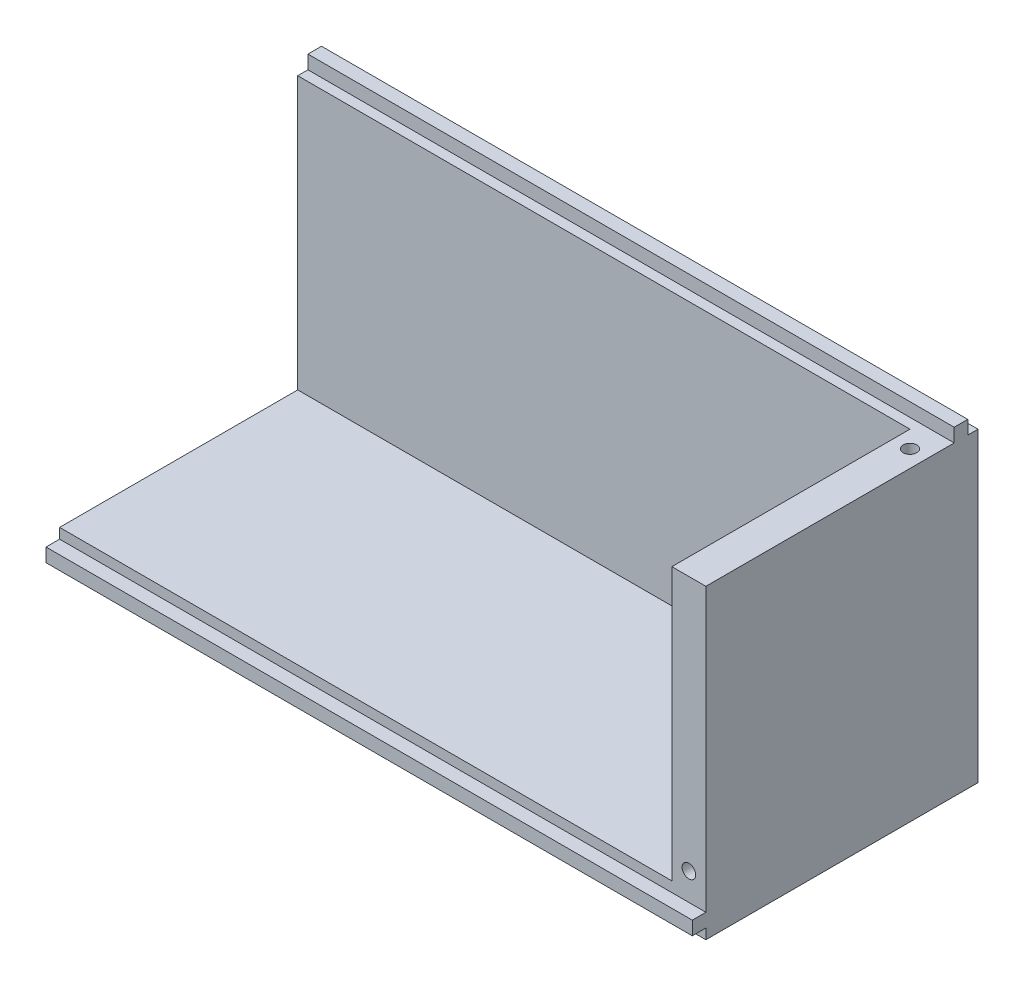
from build123d import *

# Parameters (mm, degrees)
CROQUIS1_W                                  = 95
CROQUIS1_H                                  = 40
SALIENTE_EXTRUIR1_DEPTH                     = 5
SALIENTE_EXTRUIR2_DEPTH                     = 40
CROQUIS3_W                                  = 95
CROQUIS3_H                                  = 2
SALIENTE_EXTRUIR3_DEPTH                     = 2
CROQUIS4_W                                  = 95
CROQUIS4_H                                  = 2
SALIENTE_EXTRUIR4_DEPTH                     = 2
DI_METRO_DE_TALADRO_2_0_2_1_D               = 2
DI_METRO_DE_TALADRO_2_0_2_1_DEPTH           = 10
DI_METRO_DE_TALADRO_2_0_2_1_TIP             = 0.600860619
DI_METRO_DE_TALADRO_2_0_2_2_D               = 2
DI_METRO_DE_TALADRO_2_0_2_2_DEPTH           = 10
DI_METRO_DE_TALADRO_2_0_2_2_TIP             = 0.600860619
DI_METRO_DE_TALADRO_2_0_2_2_ON_FACE_2_D     = 2
DI_METRO_DE_TALADRO_2_0_2_2_ON_FACE_2_DEPTH = 10
DI_METRO_DE_TALADRO_2_0_2_2_ON_FACE_2_TIP   = 0.600860619


with BuildPart() as part:
    # Croquis1 → Saliente-Extruir1 (new body)
    with BuildSketch(Plane(origin=(0, 0, 0), x_dir=(1, 0, 0), z_dir=(0, 1, 0))):
        with Locations((47.5, 20)):
            Rectangle(CROQUIS1_W, CROQUIS1_H)
    extrude(amount=SALIENTE_EXTRUIR1_DEPTH)

    # Croquis2 → Saliente-Extruir2 (add)
    with BuildSketch(Plane(origin=(0, 5, 0), x_dir=(1, 0, 0), z_dir=(0, 1, 0))):
        Polygon((0, 35), (90, 35), (90, 0), (95, 0), (95, 40), (0, 40), align=None)
    extrude(amount=SALIENTE_EXTRUIR2_DEPTH)

    # Croquis3 → Saliente-Extruir3 (add)
    with BuildSketch(Plane(origin=(0, 45, 0), x_dir=(1, 0, 0), z_dir=(0, 1, 0))):
        with Locations((47.5, 37.5)):
            Rectangle(CROQUIS3_W, CROQUIS3_H)
    extrude(amount=SALIENTE_EXTRUIR3_DEPTH)

    # Croquis4 → Saliente-Extruir4 (add)
    with BuildSketch(Plane.XY):
        with Locations((47.5, 2.5)):
            Rectangle(CROQUIS4_W, CROQUIS4_H)
    extrude(amount=SALIENTE_EXTRUIR4_DEPTH)

    # Diámetro de taladro Ø2.0 (2)1
    with Locations(Plane(origin=(0, 42.5, -37.5), x_dir=(0, 0, -1), z_dir=(-1, 0, 0))):
        with Locations((0, 0), (-35, 40)):
            Hole(DI_METRO_DE_TALADRO_2_0_2_1_D / 2, depth=DI_METRO_DE_TALADRO_2_0_2_1_DEPTH)
            with Locations((0, 0, -(DI_METRO_DE_TALADRO_2_0_2_1_DEPTH + DI_METRO_DE_TALADRO_2_0_2_1_TIP / 2))):  # 118° drill point
                Cone(0, DI_METRO_DE_TALADRO_2_0_2_1_D / 2, DI_METRO_DE_TALADRO_2_0_2_1_TIP, mode=Mode.SUBTRACT)

    # Diámetro de taladro Ø2.0 (2)2
    with Locations(Plane(origin=(92.5, 45, -32.5), x_dir=(0, 0, 1), z_dir=(0, 1, 0))):
        with Locations((0, 0)):
            Hole(DI_METRO_DE_TALADRO_2_0_2_2_D / 2, depth=DI_METRO_DE_TALADRO_2_0_2_2_DEPTH)
            with Locations((0, 0, -(DI_METRO_DE_TALADRO_2_0_2_2_DEPTH + DI_METRO_DE_TALADRO_2_0_2_2_TIP / 2))):  # 118° drill point
                Cone(0, DI_METRO_DE_TALADRO_2_0_2_2_D / 2, DI_METRO_DE_TALADRO_2_0_2_2_TIP, mode=Mode.SUBTRACT)

    # Diámetro de taladro Ø2.0 (2)2 on face 2
    with Locations(Plane(origin=(92.5, 7.5, 0), x_dir=(1, 0, 0), z_dir=(0, 0, 1))):
        with Locations((0, 0)):
            Hole(DI_METRO_DE_TALADRO_2_0_2_2_ON_FACE_2_D / 2, depth=DI_METRO_DE_TALADRO_2_0_2_2_ON_FACE_2_DEPTH)
            with Locations((0, 0, -(DI_METRO_DE_TALADRO_2_0_2_2_ON_FACE_2_DEPTH + DI_METRO_DE_TALADRO_2_0_2_2_ON_FACE_2_TIP / 2))):  # 118° drill point
                Cone(0, DI_METRO_DE_TALADRO_2_0_2_2_ON_FACE_2_D / 2, DI_METRO_DE_TALADRO_2_0_2_2_ON_FACE_2_TIP, mode=Mode.SUBTRACT)


solid = part.part
